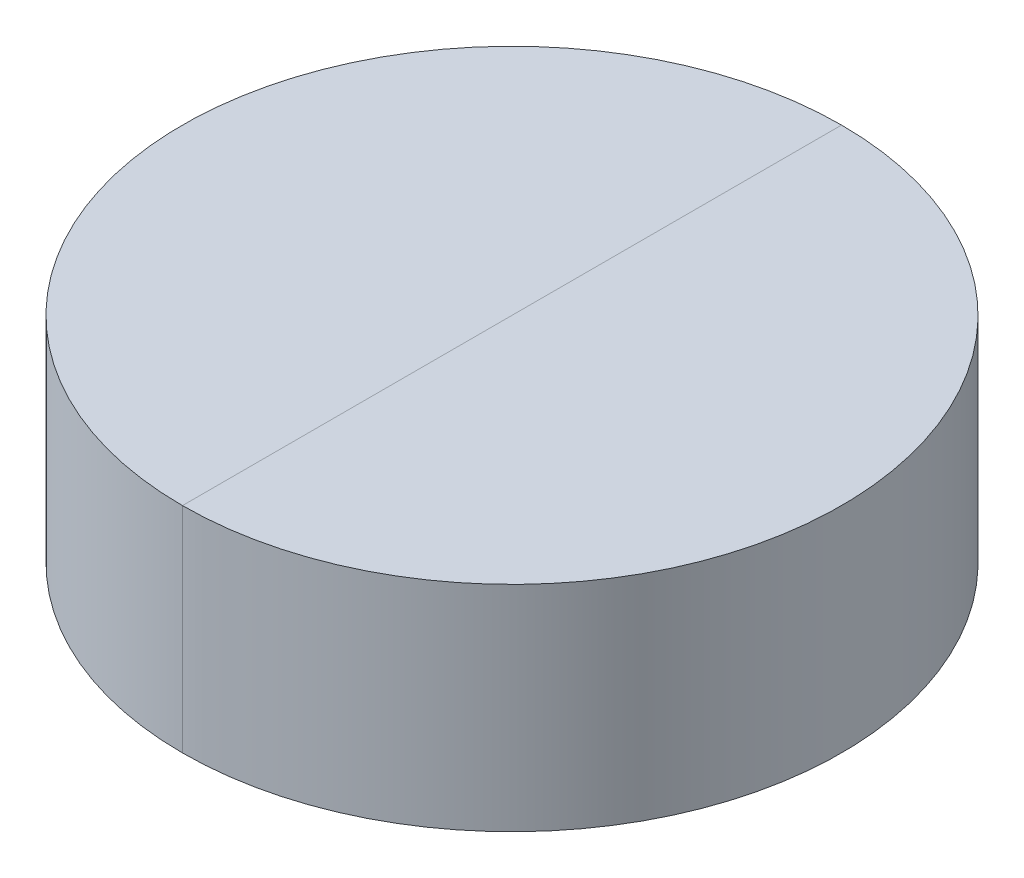
from build123d import *

# Parameters (mm, degrees)
BOSS_EXTRU_1_DEPTH = 2.6
BOSS_EXTRU_2_DEPTH = 2.6


with BuildPart() as part:
    # Esquisse1 → Boss.-Extru.1 (new body)
    with BuildSketch(Plane(origin=(0, 0, 0), x_dir=(1, 0, 0), z_dir=(0, 1, 0))):
        with BuildLine():
            Line((0, 4), (0, -4))
            ThreePointArc((0, -4), (-4, 0), (0, 4))
        make_face()
    extrude(amount=BOSS_EXTRU_1_DEPTH)


with BuildPart() as body_2:
    # Esquisse2 → Boss.-Extru.2 (new body)
    with BuildSketch(Plane(origin=(0, 0, 0), x_dir=(1, 0, 0), z_dir=(0, 1, 0))):
        with BuildLine():
            Line((0, -4), (0, 4))
            ThreePointArc((0, 4), (4, 0), (0, -4))
        make_face()
    extrude(amount=BOSS_EXTRU_2_DEPTH)


solid = Compound([part.part, body_2.part])
